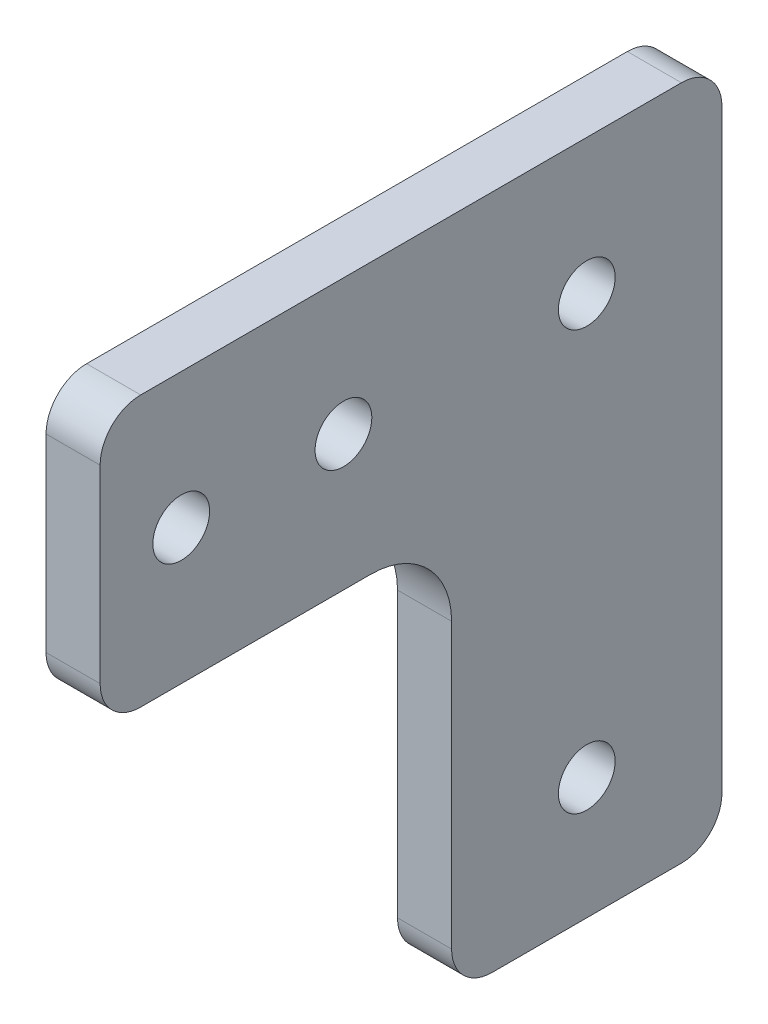
from build123d import *

# Parameters (mm, degrees)
EXTRUDE_1_DEPTH     = 4
SKETCH_3_R          = 2.1
CUT_EXTRUDE_1_DEPTH = 10


with BuildPart() as part:
    # 草图2 → 凸台-拉伸1 (new body)
    with BuildSketch(Plane(origin=(0, 0, 0), x_dir=(0, 0, -1), z_dir=(1, 0, 0))):
        with BuildLine():
            Line((-211.25, 80.041666667), (-171.25, 80.041666667))
            ThreePointArc((-171.25, 80.041666667), (-169.128679656, 79.16298701), (-168.25, 77.041666667))
            Line((-168.25, 77.041666667), (-168.25, 33.041666667))
            ThreePointArc((-168.25, 33.041666667), (-169.128679656, 30.920346323), (-171.25, 30.041666667))
            Line((-171.25, 30.041666667), (-185.25, 30.041666667))
            ThreePointArc((-185.25, 30.041666667), (-187.371320344, 30.920346323), (-188.25, 33.041666667))
            Line((-188.25, 33.041666667), (-188.25, 54.041666667))
            ThreePointArc((-188.25, 54.041666667), (-190.007359313, 58.284307354), (-194.25, 60.041666667))
            Line((-194.25, 60.041666667), (-211.25, 60.041666667))
            ThreePointArc((-211.25, 60.041666667), (-213.371320344, 60.920346323), (-214.25, 63.041666667))
            Line((-214.25, 63.041666667), (-214.25, 77.041666667))
            ThreePointArc((-214.25, 77.041666667), (-213.371320344, 79.16298701), (-211.25, 80.041666667))
        make_face()
    extrude(amount=EXTRUDE_1_DEPTH)

    # 草图3 → 切除-拉伸1 (cut)
    with BuildSketch(Plane(origin=(4, 0, 0), x_dir=(0, 0, -1), z_dir=(1, 0, 0))):
        with Locations((-208.25, 70.041666667)):
            Circle(SKETCH_3_R)
        with Locations((-178.25, 70.041666667)):
            Circle(SKETCH_3_R)
        with Locations((-178.25, 39.041666667)):
            Circle(SKETCH_3_R)
        with Locations((-196.25, 70.041666667)):
            Circle(SKETCH_3_R)
    extrude(amount=-CUT_EXTRUDE_1_DEPTH, mode=Mode.SUBTRACT)


solid = part.part
